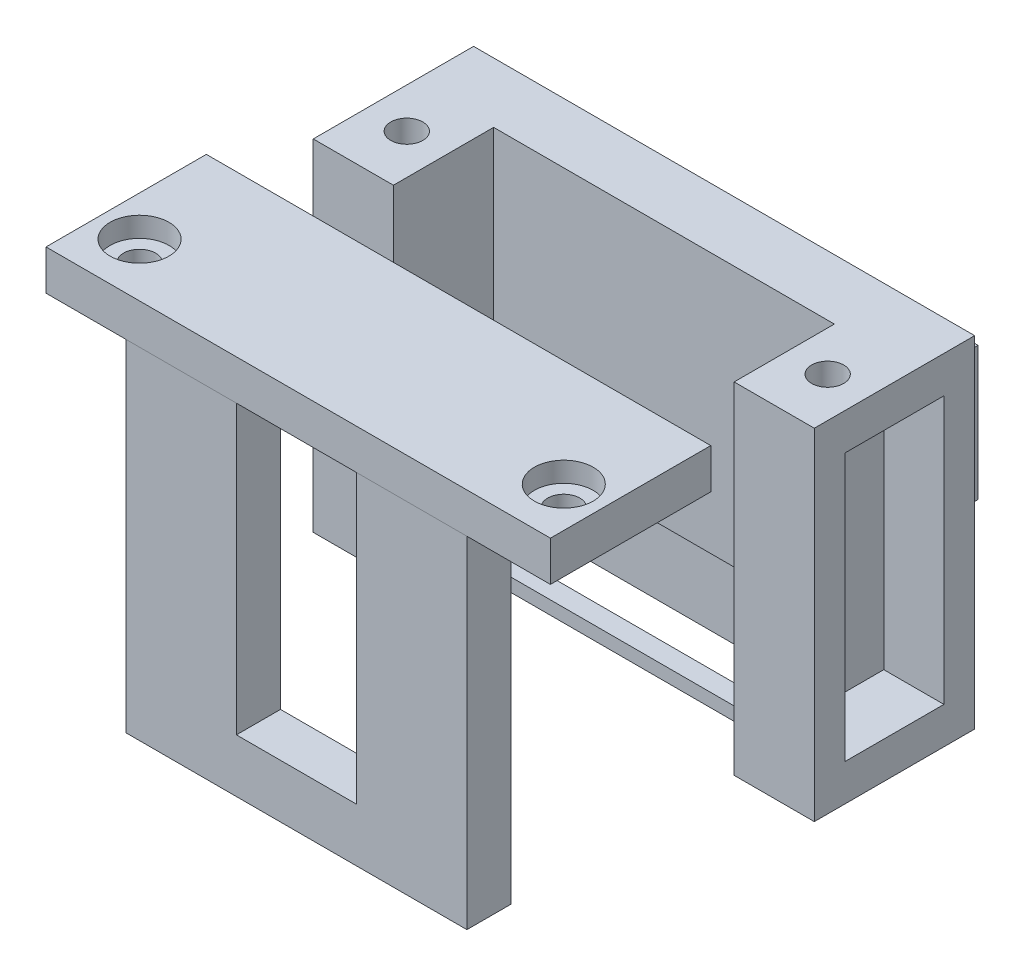
from build123d import *

# Parameters (mm, degrees)
SKETCH1_W           = 25.5
SKETCH1_H           = 3.5
BOSS_EXTRUDE1_DEPTH = 24.5
SKETCH1_3_W         = 25.5
SKETCH1_3_H         = 1.5
SKETCH1_3_H_2       = 3.5
BOSS_EXTRUDE2_DEPTH = 1
SKETCH2_R           = 1.2
CUT_EXTRUDE1_DEPTH  = 14.5
SKETCH5_W           = 7.4
SKETCH5_H           = 20
CUT_EXTRUDE3_DEPTH  = 4.5
BOSS_EXTRUDE3_START = 20
BOSS_EXTRUDE3_DEPTH = 3.3
BOSS_EXTRUDE4_START = 20
BOSS_EXTRUDE4_DEPTH = 12
SKETCH8_R           = 2.2
SKETCH8_R_2         = 1.2
CUT_EXTRUDE5_DEPTH  = 1.5
SKETCH8_3_R         = 1.2
CUT_EXTRUDE6_DEPTH  = 3
CUT_EXTRUDE7_START  = -37.5
SKETCH5_2_W         = 7.4
SKETCH5_2_H         = 20
CUT_EXTRUDE7_DEPTH  = 4.5
SKETCH9_W           = 25.5
SKETCH9_H           = 19.5
BOSS_EXTRUDE5_DEPTH = 1
SKETCH10_W          = 8
SKETCH10_H          = 10
BOSS_EXTRUDE6_DEPTH = 15
SKETCH11_R          = 2.5
CUT_EXTRUDE8_DEPTH  = 45.286002303


with BuildPart() as part:
    # Sketch1 → Boss-Extrude1 (new body)
    with BuildSketch(Plane(origin=(0, 0, 0), x_dir=(1, 0, 0), z_dir=(0, 1, 0))):
        Polygon((-12.75, -2.5), (-12.75, -1), (-12.75, 2.5), (-12.75, 6), (-18.75, 6), (-18.75, -6), (-12.75, -6), align=None)
        with Locations((0, 4.25)):
            Rectangle(SKETCH1_W, SKETCH1_H)
        Polygon((12.75, 2.5), (12.75, -1), (12.75, -2.5), (12.75, -6), (18.75, -6), (18.75, 6), (12.75, 6), align=None)
    extrude(amount=BOSS_EXTRUDE1_DEPTH)

    # Sketch1<3> → Boss-Extrude2 (add)
    with BuildSketch(Plane(origin=(0, 0, 0), x_dir=(1, 0, 0), z_dir=(0, 1, 0))):
        with Locations((0, -1.75)):
            Rectangle(SKETCH1_3_W, SKETCH1_3_H)
        Polygon((-12.75, -2.5), (-12.75, -1), (-12.75, 2.5), (-12.75, 6), (-18.75, 6), (-18.75, -6), (-12.75, -6), align=None)
        with Locations((0, 4.25)):
            Rectangle(SKETCH1_3_W, SKETCH1_3_H_2)
        Polygon((12.75, 2.5), (12.75, -1), (12.75, -2.5), (12.75, -6), (18.75, -6), (18.75, 6), (12.75, 6), align=None)
    extrude(amount=-BOSS_EXTRUDE2_DEPTH)

    # Sketch2 → Cut-Extrude1 (cut)
    with BuildSketch(Plane(origin=(0, 24.5, 0), x_dir=(1, 0, 0), z_dir=(0, 1, 0))):
        with Locations(Location((-15.75, -2, 0), (0, 0, 270))):
            Circle(SKETCH2_R)
        with Locations(Location((15.75, -2, 0), (0, 0, 270))):
            Circle(SKETCH2_R)
    extrude(amount=-CUT_EXTRUDE1_DEPTH, mode=Mode.SUBTRACT)

    # Sketch5 → Cut-Extrude3 (cut)
    with BuildSketch(Plane(origin=(18.75, 0, 0), x_dir=(0, 0, -1), z_dir=(1, 0, 0))):
        with Locations((0, 11.75)):
            Rectangle(SKETCH5_W, SKETCH5_H)
    extrude(amount=-CUT_EXTRUDE3_DEPTH, mode=Mode.SUBTRACT)

    # Sketch5<2> → Cut-Extrude7 (cut)
    with BuildSketch(Plane(origin=(18.75, 0, 0), x_dir=(0, 0, -1), z_dir=(1, 0, 0)).offset(CUT_EXTRUDE7_START)):
        with Locations((0, 11.75)):
            Rectangle(SKETCH5_2_W, SKETCH5_2_H)
    extrude(amount=CUT_EXTRUDE7_DEPTH, mode=Mode.SUBTRACT)

    # Sketch9 → Boss-Extrude5 (add)
    with BuildSketch(Plane.XY.offset(-2.5)):
        with Locations((0, 14.75)):
            Rectangle(SKETCH9_W, SKETCH9_H)
    extrude(amount=BOSS_EXTRUDE5_DEPTH)

    # Sketch10 → Boss-Extrude6 (add)
    with BuildSketch(Plane(origin=(0, 0, -6), x_dir=(-1, 0, 0), z_dir=(0, 0, -1))):
        with Locations((0, 4)):
            Rectangle(SKETCH10_W, SKETCH10_H)
    extrude(amount=BOSS_EXTRUDE6_DEPTH)

    # Sketch11 → Cut-Extrude8 (cut, through all)
    with BuildSketch(Plane.ZY.offset(4)):
        with Locations((-16, 4)):
            Circle(SKETCH11_R)
    extrude(amount=-CUT_EXTRUDE8_DEPTH, mode=Mode.SUBTRACT)


with BuildPart() as body_2:
    # Sketch7 → Boss-Extrude3 (new body)
    with BuildSketch(Plane.XY.offset(6).offset(BOSS_EXTRUDE3_START)):
        Polygon((-4.5, 24.5), (-12.75, 24.5), (-12.75, -1), (12.75, -1), (12.75, 24.5), (4.5, 24.5), (4.5, 15.5), (4.5, 3), (-4.5, 3), (-4.5, 15.5), align=None)
    extrude(amount=-BOSS_EXTRUDE3_DEPTH)


with BuildPart() as body_3:
    # Sketch7<3> → Boss-Extrude4 (new body)
    with BuildSketch(Plane.XY.offset(6).offset(BOSS_EXTRUDE4_START)):
        Polygon((-18.75, 24.5), (-12.75, 24.5), (-4.5, 24.5), (4.5, 24.5), (12.75, 24.5), (19, 24.5), (19, 27.5), (-18.75, 27.5), align=None)
    extrude(amount=-BOSS_EXTRUDE4_DEPTH)

    # Sketch8 → Cut-Extrude5 (cut)
    # profile 1 of 2: a face of its own
    with BuildSketch(Plane(origin=(0, 27.5, 0), x_dir=(1, 0, 0), z_dir=(0, 1, 0))):
        with Locations(Location((-15.75, -22, 0), (0, 0, 270))):
            Circle(SKETCH8_R)
    # profile 2 of 2: a face of its own
    with BuildSketch(Plane(origin=(0, 27.5, 0), x_dir=(1, 0, 0), z_dir=(0, 1, 0))):
        with Locations(Location((16, -22, 0), (0, 0, 270))):
            Circle(SKETCH8_R)
        with Locations(Location((16, -22, 0), (0, 0, 270))):
            Circle(SKETCH8_R_2, mode=Mode.SUBTRACT)
    extrude(amount=-CUT_EXTRUDE5_DEPTH, mode=Mode.SUBTRACT)

    # Sketch8<3> → Cut-Extrude6 (cut)
    with BuildSketch(Plane(origin=(0, 27.5, 0), x_dir=(1, 0, 0), z_dir=(0, 1, 0))):
        with Locations(Location((-15.75, -22, 0), (0, 0, 270))):
            Circle(SKETCH8_3_R)
        with Locations(Location((16, -22, 0), (0, 0, 270))):
            Circle(SKETCH8_3_R)
    extrude(amount=-CUT_EXTRUDE6_DEPTH, mode=Mode.SUBTRACT)


solid = Compound([part.part, body_2.part, body_3.part])
